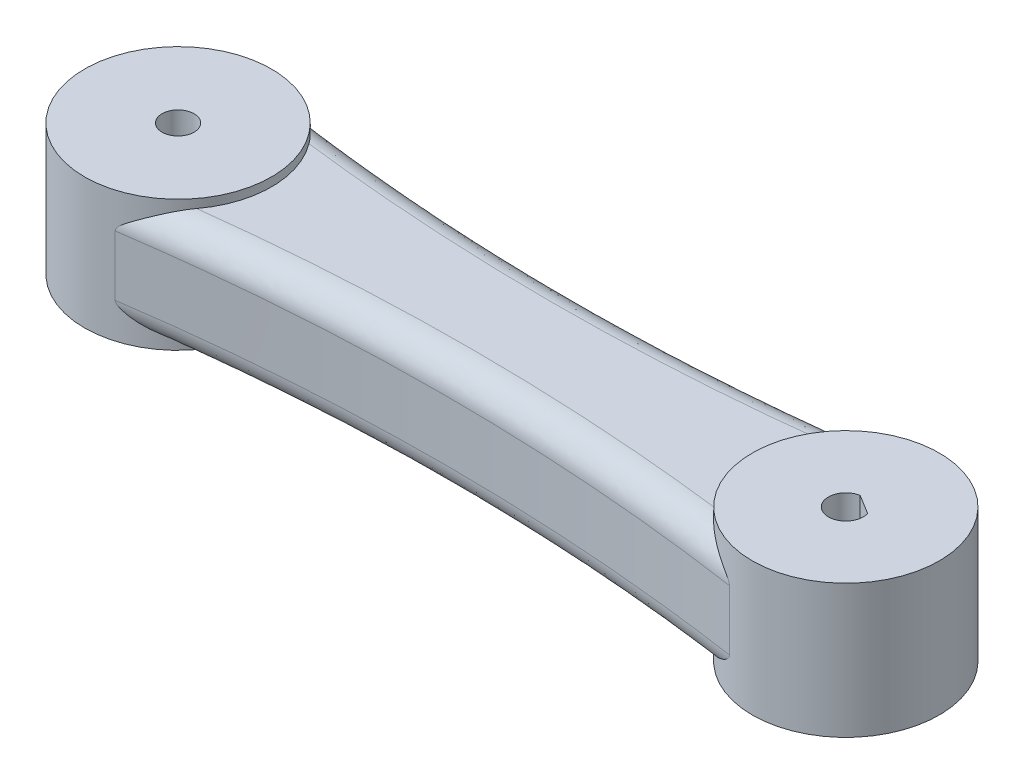
from build123d import *

# Parameters (mm, degrees)
BOSS_EXTRUDE3_DEPTH  = 42.5
SKETCH5_3_R          = 70
BOSS_EXTRUDE4_DEPTH  = 49
SKETCH5_6_R          = 70
BOSS_EXTRUDE11_DEPTH = 50
FILLET5_R            = 20
SKETCH6_R            = 12
CUT_EXTRUDE1_DEPTH   = 112
CUT_EXTRUDE2_DEPTH   = 151


with BuildPart() as part:
    # Sketch5 → Boss-Extrude3 (new, symmetric)
    with BuildSketch(Plane(origin=(0, 0, 0), x_dir=(1, 0, 0), z_dir=(0, 1, 0))):
        with BuildLine():
            ThreePointArc((215.042236358, -33.742230992), (251.167097159, -58.991268991), (265.042236358, -100.824270317))
            ThreePointArc((265.042236358, -100.824270317), (251.167097159, -142.657271644), (215.042236358, -167.906309642))
            add(Edge.make_bspline(
                [(215.042236358, -167.906309642), (445.042236358, -134.071536156), (675.042236358, -167.906309642)],
                knots=[0, 0, 0, 1, 1, 1], degree=2))
            ThreePointArc((675.042236358, -167.906309642), (625.042236358, -100.824270317), (675.042236358, -33.742230992))
            add(Edge.make_bspline(
                [(215.042236358, -33.742230992), (445.042236358, -67.577004479), (675.042236358, -33.742230992)],
                knots=[0, 0, 0, 1, 1, 1], degree=2))
        make_face()
    extrude(amount=BOSS_EXTRUDE3_DEPTH, both=True)

    # Sketch5<3> → Boss-Extrude4 (add, symmetric)
    with BuildSketch(Plane(origin=(0, 0, 0), x_dir=(1, 0, 0), z_dir=(0, 1, 0))):
        with Locations(Location((195.042236358, -100.824270317, 0), (0, 0, 270))):
            Circle(SKETCH5_3_R)
    extrude(amount=BOSS_EXTRUDE4_DEPTH, both=True)

    # Sketch5<6> → Boss-Extrude11 (add, symmetric)
    with BuildSketch(Plane(origin=(0, 0, 0), x_dir=(1, 0, 0), z_dir=(0, 1, 0))):
        with Locations(Location((695.042236358, -100.824270317, 0), (0, 0, 270))):
            Circle(SKETCH5_6_R)
    extrude(amount=BOSS_EXTRUDE11_DEPTH, both=True)

    # Fillet5
    fillet5_edges = [part.edges().sort_by_distance(p)[0] for p in [
        (445.042236357, 42.5, 150.988922899),
        (445.042236357, 42.5, 50.659617736),
        (445.042236357, -42.5, 150.988922899),
        (445.042236357, -42.5, 50.659617736),
    ]]
    fillet(fillet5_edges, radius=FILLET5_R)

    # Sketch6 → Cut-Extrude1 (cut)
    with BuildSketch(Plane(origin=(0, -50, 0), x_dir=(1, 0, 0), z_dir=(0, 1, 0))):
        with Locations(Location((195.042236357, -100.824270318, 0), (0, 0, 270))):
            Circle(SKETCH6_R)
    extrude(amount=CUT_EXTRUDE1_DEPTH, mode=Mode.SUBTRACT)

    # Sketch10 → Cut-Extrude2 (cut)
    with BuildSketch(Plane.XZ.offset(50)):
        with BuildLine():
            Line((707.431750575, 96.887274325), (692.978208818, 87.989170384))
            ThreePointArc((692.978208818, 87.989170384), (688.226960704, 111.894591803), (707.431750575, 96.887274325))
        make_face()
    extrude(amount=-CUT_EXTRUDE2_DEPTH, mode=Mode.SUBTRACT)


solid = part.part
